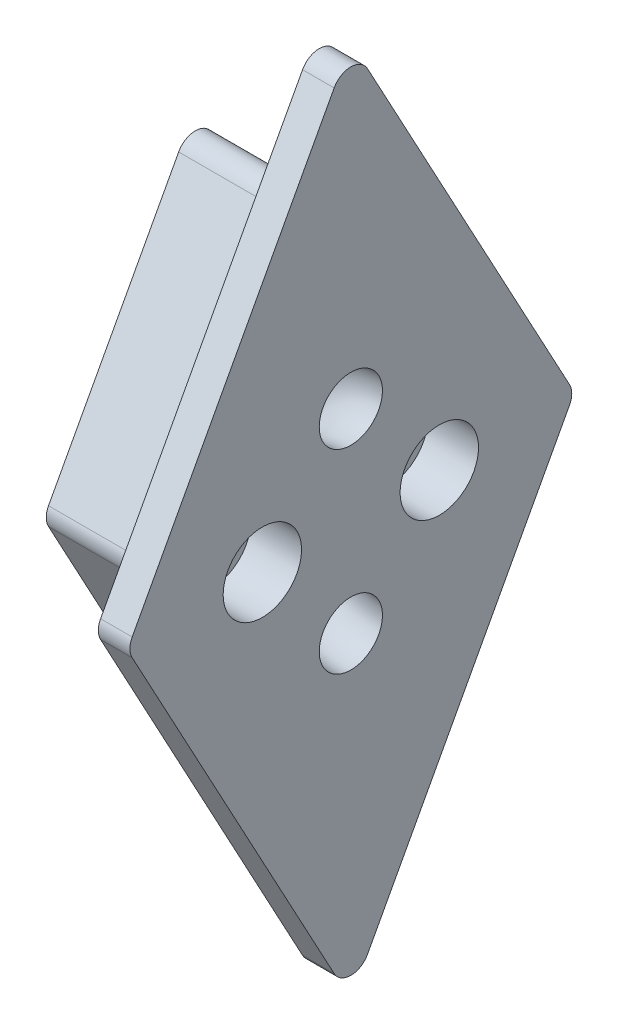
from build123d import *

# Parameters (mm, degrees)
BOSS_EXTRUDE1_DEPTH = 12.446
BOSS_EXTRUDE3_DEPTH = 3.175
FILLET1_R           = 1.905
SKETCH7_R           = 3.175
SKETCH8_R           = 3.937
CUT_EXTRUDE3_DEPTH  = 5.08
SKETCH9_R           = 2.5527
CUT_EXTRUDE4_DEPTH  = 47.541246528


with BuildPart() as part:
    # Sketch1 → Boss-Extrude1 (new body)
    with BuildSketch(Plane(origin=(0, 0, 0), x_dir=(0, 0, -1), z_dir=(1, 0, 0))):
        Polygon((0, -28.2575), (15.24, 0), (0, 28.2575), (-15.24, 0), align=None)
    extrude(amount=BOSS_EXTRUDE1_DEPTH)

    # Sketch6 → Boss-Extrude3 (add)
    with BuildSketch(Plane(origin=(12.446, 0, 0), x_dir=(0, 0, -1), z_dir=(1, 0, 0))):
        Polygon((-22.454651823, 0), (0, -41.634666921), (22.454651823, 0), (0, 41.634666921), align=None)
    extrude(amount=BOSS_EXTRUDE3_DEPTH)

    # Fillet1
    fillet1_edges = [part.edges().sort_by_distance(p)[0] for p in [
        (14.0335, 41.634666921, 0),
        (14.0335, 0, 22.454651823),
        (14.0335, -41.634666921, 0),
        (14.0335, 0, -22.454651823),
        (6.223, 0, -15.24),
        (6.223, -28.2575, 0),
        (6.223, 0, 15.24),
        (6.223, 28.2575, 0),
    ]]
    fillet(fillet1_edges, radius=FILLET1_R)

    # Sketch7 → Cut-Revolve2 (revolve, cut)
    with BuildSketch(Plane(origin=(0, 0, 0), x_dir=(1, 0, 0), z_dir=(0, 1, 0))):
        with Locations((6.096, 0)):
            Circle(SKETCH7_R)
    revolve(axis=Axis((15.875, 0, 0), (0, 0, 1)), mode=Mode.SUBTRACT)

    # Sketch8 → Cut-Extrude3 (cut)
    with BuildSketch(Plane(origin=(15.621, 0, 0), x_dir=(0, 0, -1), z_dir=(1, 0, 0))):
        with Locations((8.89, 0)):
            Circle(SKETCH8_R)
        with Locations(Location((-8.89, 0, 0), (0, 0, 180))):
            Circle(SKETCH8_R)
    extrude(amount=-CUT_EXTRUDE3_DEPTH, mode=Mode.SUBTRACT)

    # Sketch9 → Cut-Extrude4 (cut, through all)
    with BuildSketch(Plane(origin=(10.541, 0, 0), x_dir=(0, 0, -1), z_dir=(1, 0, 0))):
        with Locations((8.89, 0)):
            Circle(SKETCH9_R)
        with Locations(Location((-8.89, 0, 0), (0, 0, 180))):
            Circle(SKETCH9_R)
    extrude(amount=-CUT_EXTRUDE4_DEPTH, mode=Mode.SUBTRACT)


solid = part.part
